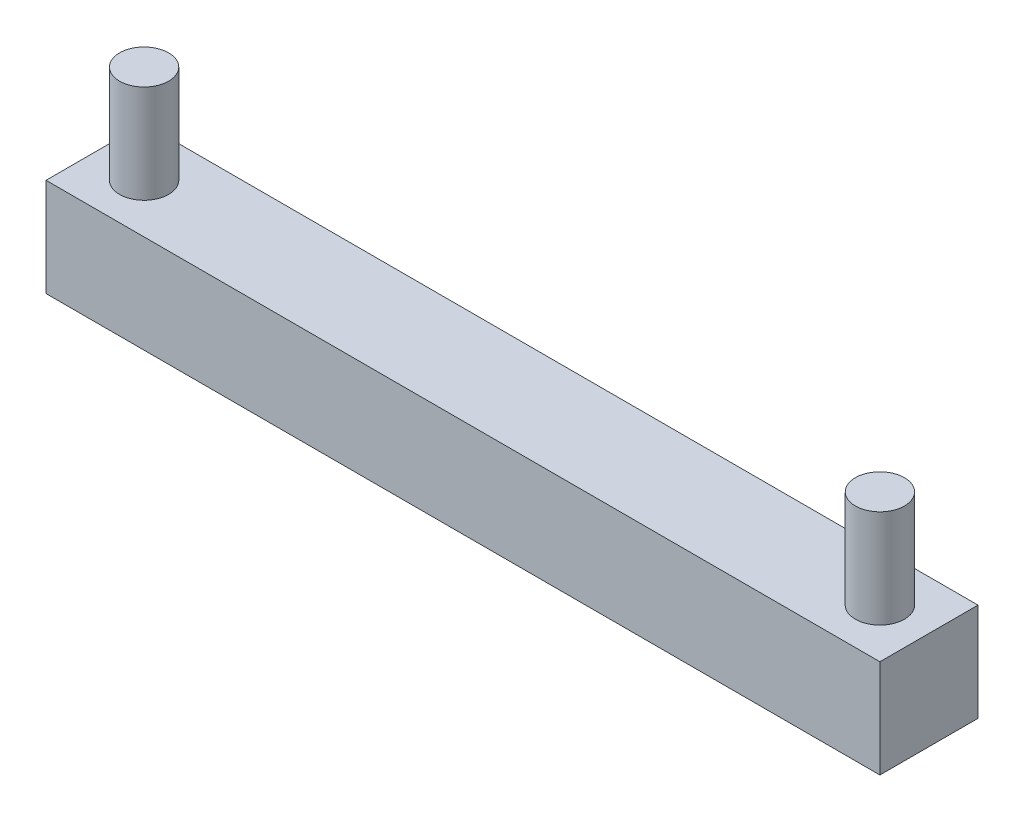
from build123d import *

# Parameters (mm, degrees)
ESQUISSE1_W        = 85
ESQUISSE1_H        = 10
BOSS_EXTRU_1_DEPTH = 10
ESQUISSE2_R        = 2.5
BOSS_EXTRU_2_DEPTH = 10


with BuildPart() as part:
    # Esquisse1 → Boss.-Extru.1 (new body)
    with BuildSketch(Plane(origin=(0, 0, 0), x_dir=(1, 0, 0), z_dir=(0, 1, 0))):
        with Locations((42.5, -5)):
            Rectangle(ESQUISSE1_W, ESQUISSE1_H)
    extrude(amount=BOSS_EXTRU_1_DEPTH)

    # Esquisse2 → Boss.-Extru.2 (add)
    with BuildSketch(Plane(origin=(0, 10, 0), x_dir=(1, 0, 0), z_dir=(0, 1, 0))):
        with Locations(Location((5, -5, 0), (0, 0, 270))):
            Circle(ESQUISSE2_R)
        with Locations(Location((80, -5, 0), (0, 0, 270))):
            Circle(ESQUISSE2_R)
    extrude(amount=BOSS_EXTRU_2_DEPTH)


solid = part.part
